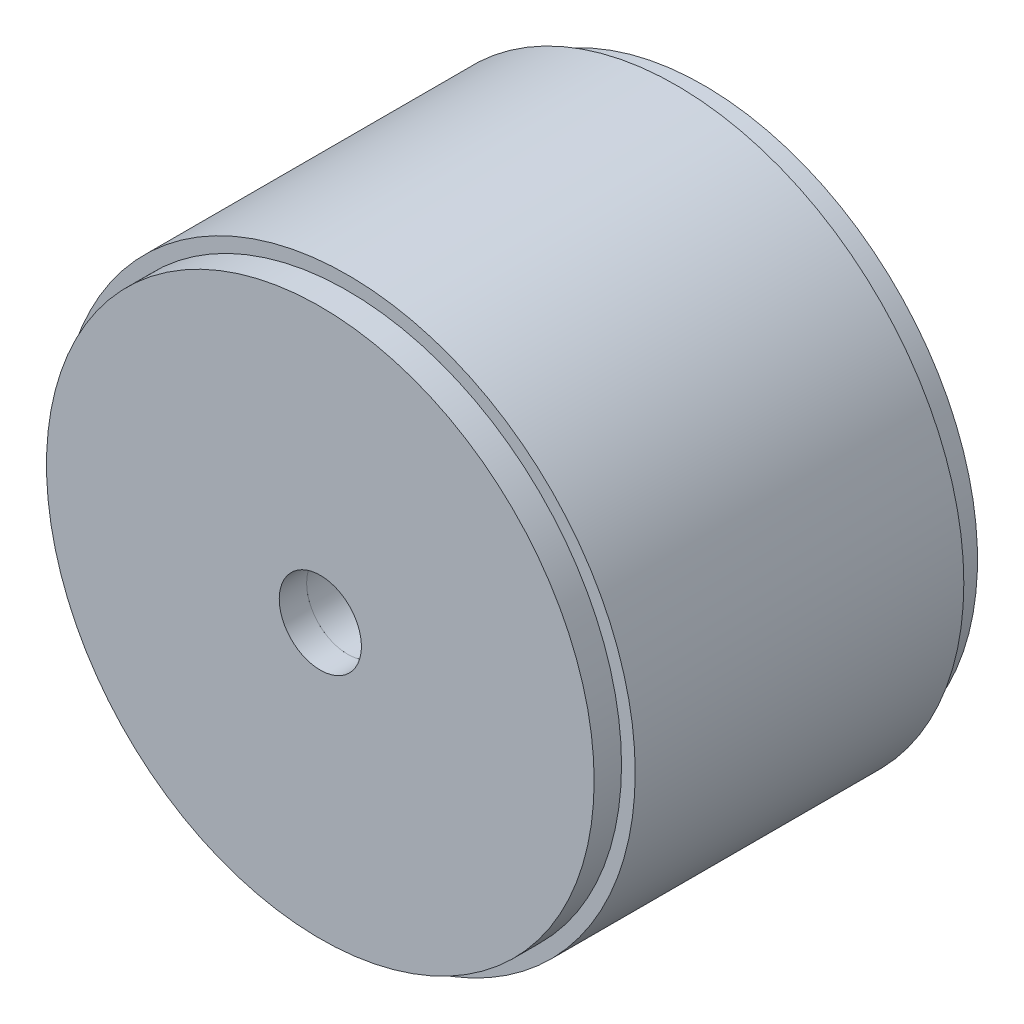
from build123d import *

# Parameters (mm, degrees)
CROQUIS1_R              = 10.5
SALIENTE_EXTRUIR1_DEPTH = 12
CROQUIS2_R              = 10
SALIENTE_EXTRUIR2_DEPTH = 1
CROQUIS3_R              = 10
SALIENTE_EXTRUIR3_DEPTH = 1
CROQUIS4_R              = 1.5
CORTAR_EXTRUIR1_DEPTH   = 21.408331632


with BuildPart() as part:
    # Croquis1 → Saliente-Extruir1 (new body)
    with BuildSketch(Plane.XY):
        Circle(CROQUIS1_R)
    extrude(amount=SALIENTE_EXTRUIR1_DEPTH)


with BuildPart() as body_2:
    # Croquis2 → Saliente-Extruir2 (new body)
    with BuildSketch(Plane.XY.offset(12)):
        Circle(CROQUIS2_R)
    extrude(amount=SALIENTE_EXTRUIR2_DEPTH)


with BuildPart() as body_3:
    # Croquis3 → Saliente-Extruir3 (new body)
    with BuildSketch(Plane(origin=(0, 0, 0), x_dir=(-1, 0, 0), z_dir=(0, 0, -1))):
        Circle(CROQUIS3_R)
    extrude(amount=SALIENTE_EXTRUIR3_DEPTH)


with BuildPart() as cortar_extruir1_tool:
    # Croquis4 → Cortar-Extruir1 (new, through all)
    with BuildSketch(Plane(origin=(0, 0, -1), x_dir=(-1, 0, 0), z_dir=(0, 0, -1))):
        Circle(CROQUIS4_R)
    extrude(amount=-CORTAR_EXTRUIR1_DEPTH)


with BuildPart() as part_1:
    add(part.part)

    # Cortar-Extruir1: cut by cortar_extruir1_tool
    add(cortar_extruir1_tool.part, mode=Mode.SUBTRACT)


with BuildPart() as body_2_1:
    add(body_2.part)

    # Cortar-Extruir1: cut by cortar_extruir1_tool
    add(cortar_extruir1_tool.part, mode=Mode.SUBTRACT)


with BuildPart() as body_3_1:
    add(body_3.part)

    # Cortar-Extruir1: cut by cortar_extruir1_tool
    add(cortar_extruir1_tool.part, mode=Mode.SUBTRACT)


solid = Compound([part_1.part, body_2_1.part, body_3_1.part])
